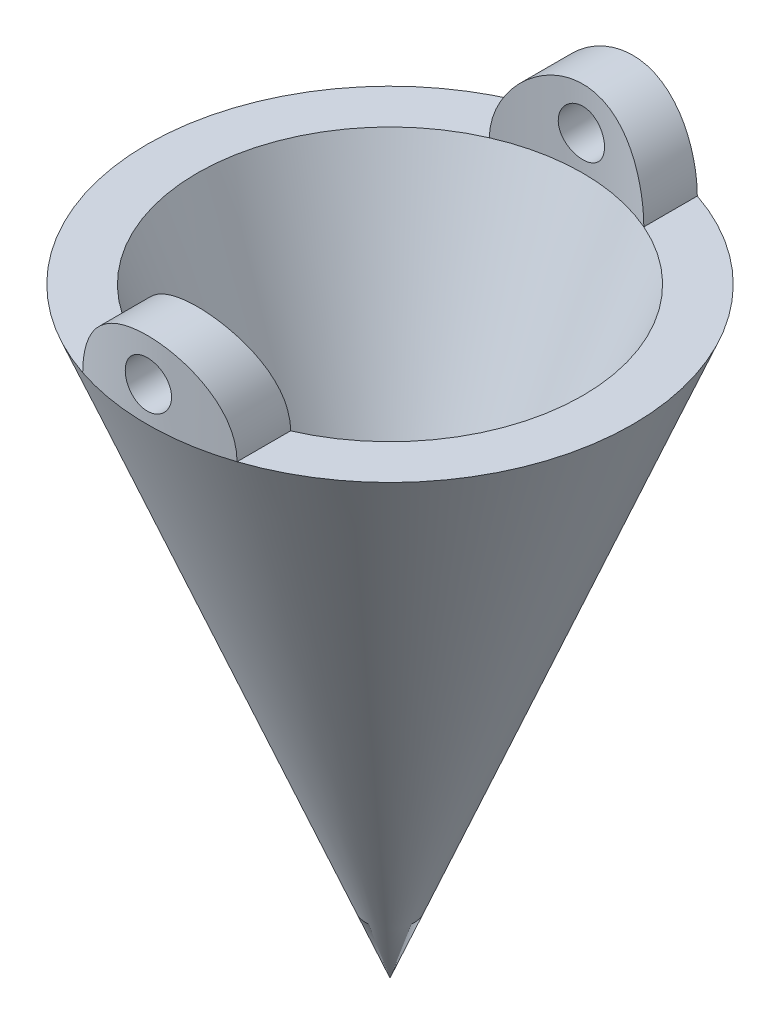
from build123d import *

# Parameters (mm, degrees)
SALIENTE_EXTRUIR1_DEPTH = 10
CORTAR_EXTRUIR1_DEPTH   = 113.828716794
CROQUIS5_R              = 3
CORTAR_EXTRUIR2_DEPTH   = 113.828716928


with BuildPart() as part:
    # Croquis1 → Revolución1 (revolve)
    with BuildSketch(Plane.XY):
        Polygon((0, 0), (-31.448700737, 77.838265751), (-24.977492281, 77.838265751), (0, 16.016802975), align=None)
    revolve(axis=Axis((0, 0, 0), (0, 1, 0)))

    # Croquis2 → Saliente-Extruir1 (add)
    with BuildSketch(Plane(origin=(0, 77.838265751, 0), x_dir=(1, 0, 0), z_dir=(0, 1, 0))):
        with BuildLine():
            Line((10, -22.888318432), (10, -29.816451466))
            ThreePointArc((10, -29.816451466), (0, -31.448700737), (-10, -29.816451466))
            Line((-10, -29.816451466), (-10, -22.888318432))
            ThreePointArc((-10, -22.888318432), (0, -24.977492281), (10, -22.888318432))
        make_face()
        with BuildLine():
            Line((10, 22.888318432), (10, 29.816451466))
            ThreePointArc((10, 29.816451466), (0, 31.448700737), (-10, 29.816451466))
            Line((-10, 29.816451466), (-10, 22.888318432))
            ThreePointArc((-10, 22.888318432), (0, 24.977492281), (10, 22.888318432))
        make_face()
    extrude(amount=SALIENTE_EXTRUIR1_DEPTH)

    # Croquis3 → Cortar-Extruir1 (cut, through all)
    with BuildSketch(Plane.XY.offset(32)):
        with BuildLine():
            Line((10, 87.838265751), (10, 77.838265751))
            ThreePointArc((10, 77.838265751), (7.071067812, 84.909333563), (0, 87.838265751))
            Line((0, 87.838265751), (10, 87.838265751))
        make_face()
    extrude(amount=-CORTAR_EXTRUIR1_DEPTH, mode=Mode.SUBTRACT)

    # Croquis5 → Cortar-Extruir2 (cut, through all)
    with BuildSketch(Plane.XY.offset(32)):
        with Locations((0, 82.338265751)):
            Circle(CROQUIS5_R)
        with BuildLine():
            Line((-10, 77.838265751), (-10, 87.838265751))
            Line((-10, 87.838265751), (0, 87.838265751))
            ThreePointArc((0, 87.838265751), (-7.071067812, 84.909333563), (-10, 77.838265751))
        make_face()
    extrude(amount=-CORTAR_EXTRUIR2_DEPTH, mode=Mode.SUBTRACT)


solid = part.part
